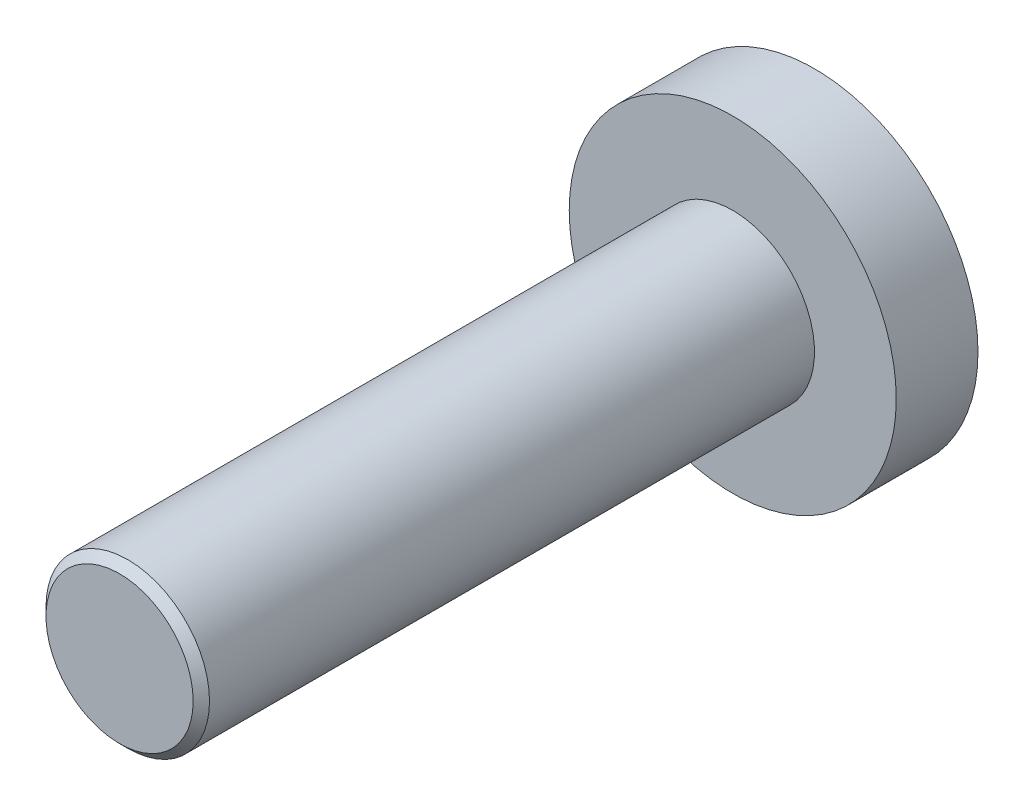
from build123d import *

# Parameters (mm, degrees)
SKETCH_1_R      = 2
EXTRUDE_1_DEPTH = 15
SKETCH_2_R      = 4
EXTRUDE_2_DEPTH = 2
CHAMFER_1_SIZE  = 0.2


with BuildPart() as part:
    # 草图1 → 拉伸1 (new body)
    with BuildSketch(Plane.XY):
        Circle(SKETCH_1_R)
    extrude(amount=EXTRUDE_1_DEPTH)

    # 草图2 → 拉伸2 (add)
    with BuildSketch(Plane(origin=(0, 0, 0), x_dir=(-1, 0, 0), z_dir=(0, 0, -1))):
        Circle(SKETCH_2_R)
    extrude(amount=EXTRUDE_2_DEPTH)

    # 倒角1
    chamfer_1_edges = [part.edges().sort_by_distance(p)[0] for p in [
        (-2, 0, 15),
    ]]
    chamfer(chamfer_1_edges, length=CHAMFER_1_SIZE)


solid = part.part
